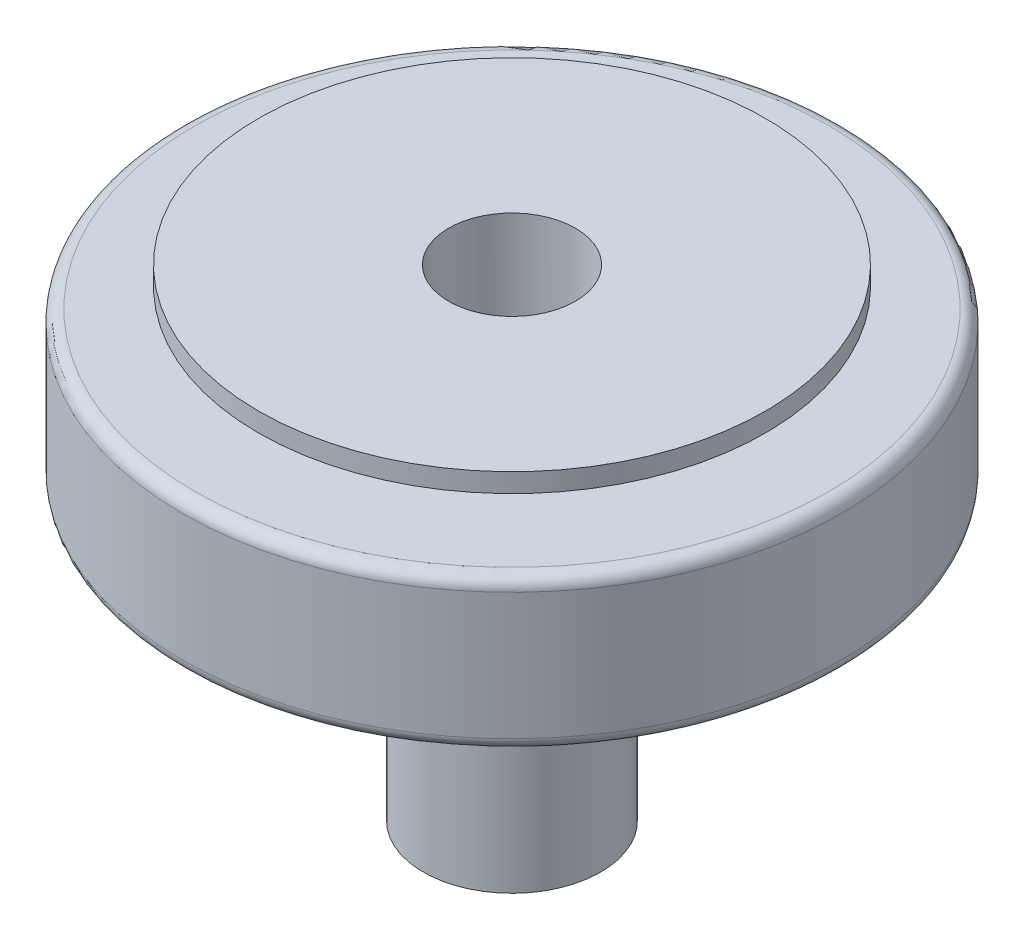
from build123d import *

# Parameters (mm, degrees)
SKETCH_1_R          = 26
EXTRUDE_1_DEPTH     = 12
SKETCH_2_R          = 17.5
EXTRUDE_2_DEPTH     = 1.5
EXTRUDE_START       = 1.5
SKETCH_3_R          = 17.5
EXTRUDE_3_DEPTH     = 1.5
SKETCH_4_R          = 20
EXTRUDE_4_DEPTH     = 1.5
SKETCH_5_R          = 20
EXTRUDE_5_DEPTH     = 1.5
SKETCH_6_R          = 5
CUT_EXTRUDE_1_DEPTH = 41.938978981
EXTRUDE_START_2     = 20
SKETCH_7_R          = 7
SKETCH_7_R_2        = 5
EXTRUDE_6_DEPTH     = 20
SKETCH_8_R          = 2
CUT_EXTRUDE_2_DEPTH = 44.370496884
SKETCH_9_R          = 2
CUT_EXTRUDE_3_DEPTH = 44.370496937
FILLET_1_R          = 1
FILLET_2_R          = 1


with BuildPart() as part:
    # 草图1 → 凸台-拉伸1 (new body)
    with BuildSketch(Plane(origin=(0, 0, 0), x_dir=(1, 0, 0), z_dir=(0, 1, 0))):
        with Locations(Location((0, 0, 0), (0, 0, 270))):
            Circle(SKETCH_1_R)
    extrude(amount=EXTRUDE_1_DEPTH)

    # 草图2 → 凸台-拉伸2 (add)
    with BuildSketch(Plane(origin=(0, 12, 0), x_dir=(1, 0, 0), z_dir=(0, 1, 0))):
        with Locations(Location((0, 0, 0), (0, 0, 270))):
            Circle(SKETCH_2_R)
    extrude(amount=EXTRUDE_2_DEPTH)

    # 草图3 → 凸台-拉伸3 (add)
    with BuildSketch(Plane.XZ.offset(EXTRUDE_START)):
        with Locations(Location((0, 0, 0), (0, 0, 90))):
            Circle(SKETCH_3_R)
    extrude(amount=-EXTRUDE_3_DEPTH)

    # 草图4 → 凸台-拉伸4 (add)
    with BuildSketch(Plane(origin=(0, 13.5, 0), x_dir=(1, 0, 0), z_dir=(0, 1, 0))):
        with Locations(Location((0, 0, 0), (0, 0, 270))):
            Circle(SKETCH_4_R)
    extrude(amount=EXTRUDE_4_DEPTH)

    # 草图5 → 凸台-拉伸5 (add)
    with BuildSketch(Plane.XZ.offset(1.5).offset(EXTRUDE_START)):
        with Locations(Location((0, 0, 0), (0, 0, 90))):
            Circle(SKETCH_5_R)
    extrude(amount=-EXTRUDE_5_DEPTH)

    # 草图6 → 切除-拉伸1 (cut, through all)
    with BuildSketch(Plane.XZ.offset(3)):
        with Locations(Location((0, 0, 0), (0, 0, 270))):
            Circle(SKETCH_6_R)
    extrude(amount=-CUT_EXTRUDE_1_DEPTH, mode=Mode.SUBTRACT)

    # 草图7 → 凸台-拉伸6 (add)
    with BuildSketch(Plane.XZ.offset(3).offset(EXTRUDE_START_2)):
        with Locations(Location((0, 0, 0), (0, 0, 270))):
            Circle(SKETCH_7_R)
        with Locations(Location((0, 0, 0), (0, 0, 270))):
            Circle(SKETCH_7_R_2, mode=Mode.SUBTRACT)
    extrude(amount=-EXTRUDE_6_DEPTH)

    # 草图8 → 切除-拉伸2 (cut, through all)
    with BuildSketch(Plane(origin=(0, 0, 0), x_dir=(0, 0, -1), z_dir=(1, 0, 0))):
        with Locations((0, -13)):
            Circle(SKETCH_8_R)
    extrude(amount=-CUT_EXTRUDE_2_DEPTH, mode=Mode.SUBTRACT)

    # 草图9 → 切除-拉伸3 (cut, through all)
    with BuildSketch(Plane.XY):
        with Locations(Location((0, -13, 0), (0, 0, 270.00000003))):
            Circle(SKETCH_9_R)
    extrude(amount=-CUT_EXTRUDE_3_DEPTH, mode=Mode.SUBTRACT)

    # 圆角1
    fillet_1_edges = [part.edges().sort_by_distance(p)[0] for p in [
        (0, 12, -26),
    ]]
    fillet(fillet_1_edges, radius=FILLET_1_R)

    # 圆角2
    fillet_2_edges = [part.edges().sort_by_distance(p)[0] for p in [
        (0, 0, -26),
    ]]
    fillet(fillet_2_edges, radius=FILLET_2_R)


solid = part.part
